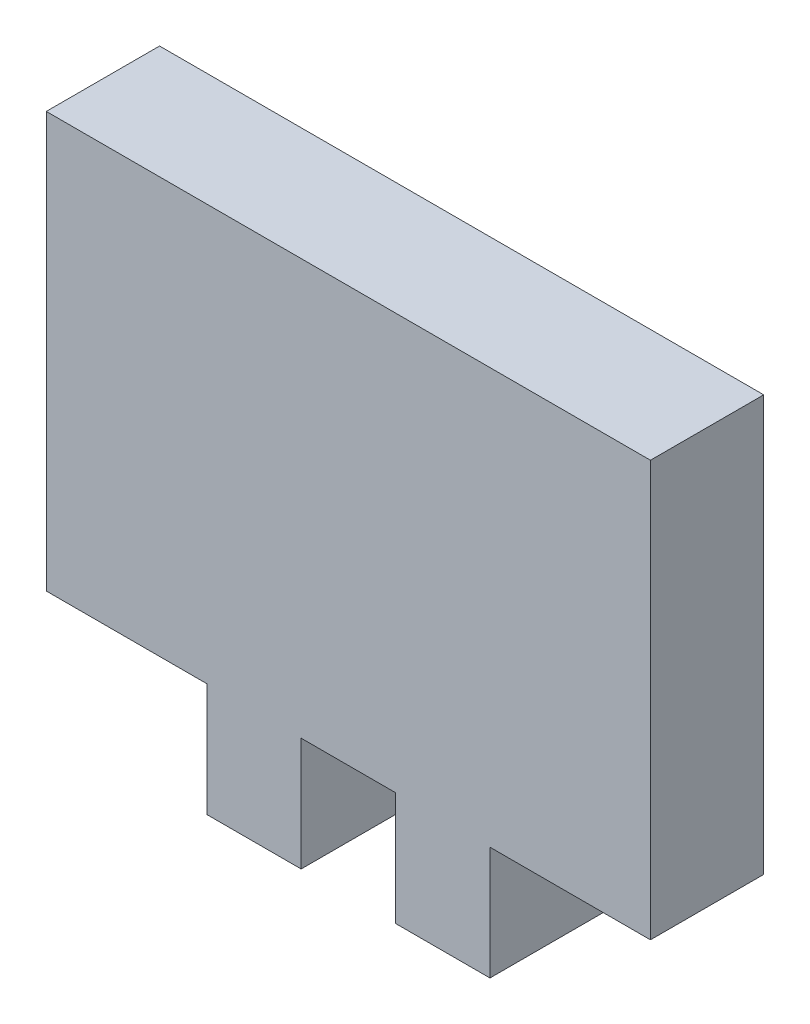
from build123d import *

# Parameters (mm, degrees)
BOSS_EXTRUDE1_DEPTH = 6


with BuildPart() as part:
    # Sketch1 → Boss-Extrude1 (new body)
    with BuildSketch(Plane.XY):
        Polygon((0, 0), (8.5, 0), (8.5, -6), (13.5, -6), (13.5, 0), (18.5, 0), (18.5, -6), (23.5, -6), (23.5, 0), (32, 0), (32, 22), (0, 22), align=None)
    extrude(amount=BOSS_EXTRUDE1_DEPTH)


solid = part.part
